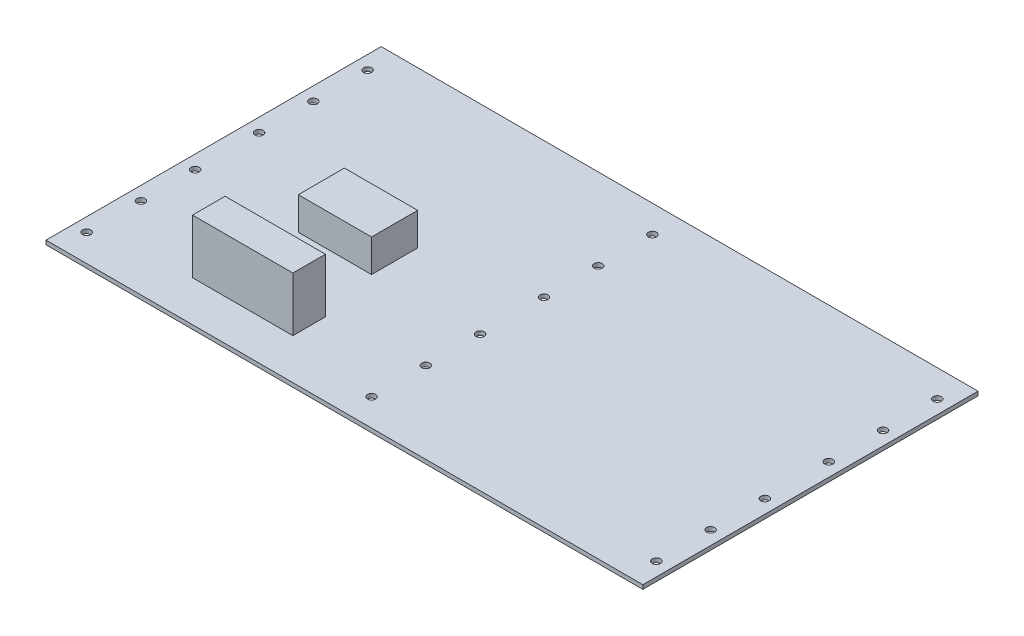
from build123d import *

# Parameters (mm, degrees)
SKETCH_1_W          = 220
SKETCH_1_H          = 123.55
EXTRUDE_1_DEPTH     = 1.5
SKETCH_2_R          = 1.5
CUT_EXTRUDE_1_DEPTH = 10
SKETCH_3_W          = 35
SKETCH_3_H          = 10
SKETCH_3_W_2        = 25
SKETCH_3_H_2        = 15
CUT_EXTRUDE_2_DEPTH = 174.45613061
SKETCH_3_3_W        = 27
SKETCH_3_3_H        = 17
SKETCH_3_3_W_2      = 25
SKETCH_3_3_H_2      = 15
EXTRUDE_2_DEPTH     = 12
SKETCH_3_4_W        = 37
SKETCH_3_4_H        = 12
SKETCH_3_4_W_2      = 35
SKETCH_3_4_H_2      = 10
EXTRUDE_3_DEPTH     = 20
SKETCH_11_W         = 17
SKETCH_11_H         = 1
EXTRUDE_4_DEPTH     = 25
SKETCH_12_W         = 12
SKETCH_12_H         = 1
EXTRUDE_5_DEPTH     = 35


with BuildPart() as part:
    # 草图1 → 凸台-拉伸1 (new body)
    with BuildSketch(Plane(origin=(0, 0, 0), x_dir=(1, 0, 0), z_dir=(0, 1, 0))):
        with Locations((44.295012832, -17.457747405)):
            Rectangle(SKETCH_1_W, SKETCH_1_H)
    extrude(amount=EXTRUDE_1_DEPTH)

    # 草图2 → 切除-拉伸1 (cut)
    with BuildSketch(Plane(origin=(0, 1.5, 0), x_dir=(1, 0, 0), z_dir=(0, 1, 0))):
        with Locations(Location((149.295012832, -69.232747405, 0), (0, 0, 270))):
            Circle(SKETCH_2_R)
        with Locations(Location((149.295012832, -49.232747405, 0), (0, 0, 270))):
            Circle(SKETCH_2_R)
        with Locations(Location((44.295012832, -49.232747405, 0), (0, 0, 270))):
            Circle(SKETCH_2_R)
        with Locations(Location((44.295012832, -69.232747405, 0), (0, 0, 270))):
            Circle(SKETCH_2_R)
        with Locations(Location((44.295012832, 14.317252595, 0), (0, 0, 270))):
            Circle(SKETCH_2_R)
        with Locations(Location((44.295012832, 34.317252595, 0), (0, 0, 270))):
            Circle(SKETCH_2_R)
        with Locations(Location((149.295012832, 14.317252595, 0), (0, 0, 270))):
            Circle(SKETCH_2_R)
        with Locations(Location((149.295012832, 34.317252595, 0), (0, 0, 270))):
            Circle(SKETCH_2_R)
        with Locations(Location((-60.704987168, 34.317252595, 0), (0, 0, 270))):
            Circle(SKETCH_2_R)
        with Locations(Location((-60.704987168, 14.317252595, 0), (0, 0, 270))):
            Circle(SKETCH_2_R)
        with Locations(Location((-60.704987168, -49.232747405, 0), (0, 0, 270))):
            Circle(SKETCH_2_R)
        with Locations(Location((-60.704987168, -69.232747405, 0), (0, 0, 270))):
            Circle(SKETCH_2_R)
        with Locations(Location((-60.704987168, -29.232747405, 0), (0, 0, 270))):
            Circle(SKETCH_2_R)
        with Locations(Location((-60.704987168, -5.682747405, 0), (0, 0, 270))):
            Circle(SKETCH_2_R)
        with Locations(Location((44.295012832, -5.682747405, 0), (0, 0, 270))):
            Circle(SKETCH_2_R)
        with Locations(Location((44.295012832, -29.232747405, 0), (0, 0, 270))):
            Circle(SKETCH_2_R)
        with Locations(Location((149.295012832, -5.682747405, 0), (0, 0, 270))):
            Circle(SKETCH_2_R)
        with Locations(Location((149.295012832, -29.232747405, 0), (0, 0, 270))):
            Circle(SKETCH_2_R)
    extrude(amount=-CUT_EXTRUDE_1_DEPTH, mode=Mode.SUBTRACT)

    # 草图3 → 切除-拉伸2 (cut, through all)
    with BuildSketch(Plane(origin=(0, 1.5, 0), x_dir=(1, 0, 0), z_dir=(0, 1, 0))):
        with Locations((-8.204987168, -58.232747405)):
            Rectangle(SKETCH_3_W, SKETCH_3_H)
        with Locations((-8.204987168, -21.732747405)):
            Rectangle(SKETCH_3_W_2, SKETCH_3_H_2)
    extrude(amount=-CUT_EXTRUDE_2_DEPTH, mode=Mode.SUBTRACT)

    # 草图3<3> → 凸台-拉伸2 (add)
    with BuildSketch(Plane(origin=(0, 1.5, 0), x_dir=(1, 0, 0), z_dir=(0, 1, 0))):
        with Locations((-8.204987168, -21.732747405)):
            Rectangle(SKETCH_3_3_W, SKETCH_3_3_H)
        with Locations((-8.204987168, -21.732747405)):
            Rectangle(SKETCH_3_3_W_2, SKETCH_3_3_H_2, mode=Mode.SUBTRACT)
    extrude(amount=EXTRUDE_2_DEPTH)

    # 草图3<4> → 凸台-拉伸3 (add)
    with BuildSketch(Plane(origin=(0, 1.5, 0), x_dir=(1, 0, 0), z_dir=(0, 1, 0))):
        with Locations((-8.204987168, -58.232747405)):
            Rectangle(SKETCH_3_4_W, SKETCH_3_4_H)
        with Locations((-8.204987168, -58.232747405)):
            Rectangle(SKETCH_3_4_W_2, SKETCH_3_4_H_2, mode=Mode.SUBTRACT)
    extrude(amount=EXTRUDE_3_DEPTH)

    # 草图11 → 凸台-拉伸4 (add)
    with BuildSketch(Plane(origin=(-20.704987168, 0, 0), x_dir=(0, 0, -1), z_dir=(1, 0, 0))):
        with Locations((-21.732747405, 13)):
            Rectangle(SKETCH_11_W, SKETCH_11_H)
    extrude(amount=EXTRUDE_4_DEPTH)

    # 草图12 → 凸台-拉伸5 (add)
    with BuildSketch(Plane(origin=(-25.704987168, 0, 0), x_dir=(0, 0, -1), z_dir=(1, 0, 0))):
        with Locations((-58.232747405, 21)):
            Rectangle(SKETCH_12_W, SKETCH_12_H)
    extrude(amount=EXTRUDE_5_DEPTH)


solid = part.part
